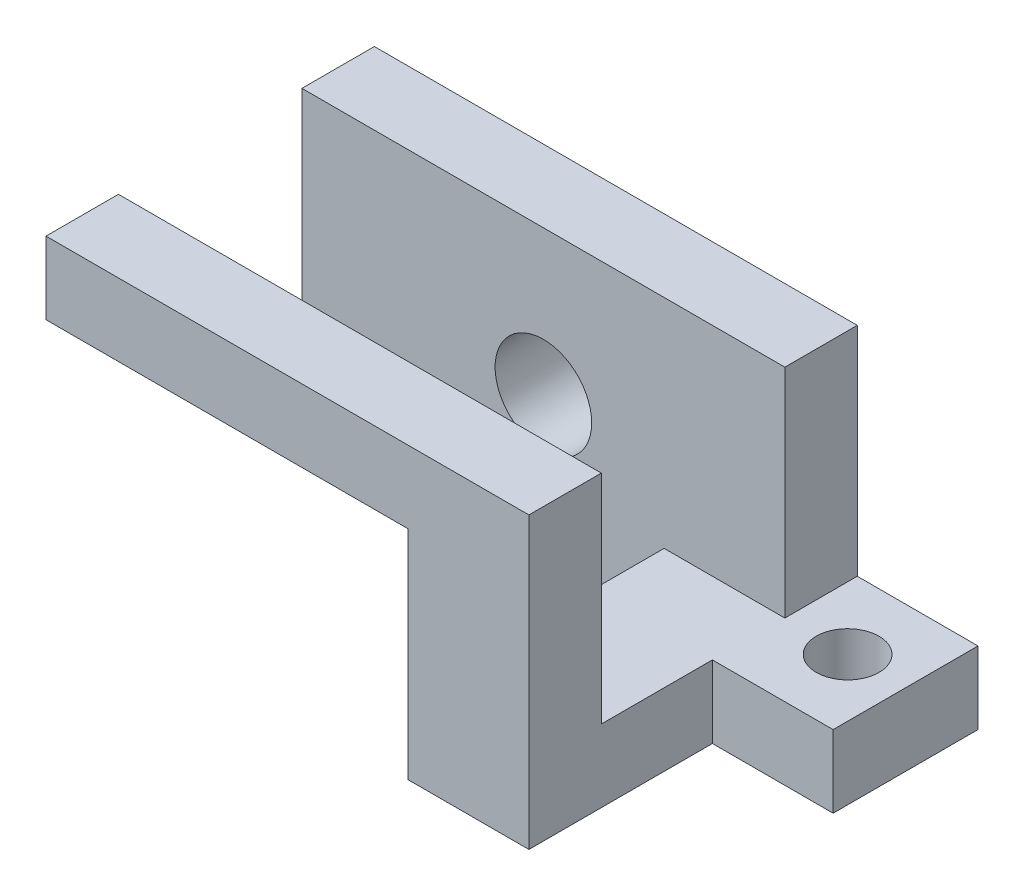
from build123d import *

# Parameters (mm, degrees)
BOSS_EXTRUDE1_DEPTH = 15
SKETCH1_5_W         = 50
SKETCH1_5_H         = 15
BOSS_EXTRUDE2_DEPTH = 30
SKETCH1_6_W         = 25
SKETCH1_6_H         = 15
BOSS_EXTRUDE3_DEPTH = 53
BOSS_EXTRUDE4_DEPTH = 15
CUT_EXTRUDE1_DEPTH  = 15


with BuildPart() as part:
    # Sketch1 → Boss-Extrude1 (new body)
    with BuildSketch(Plane.XY):
        Polygon((-50, -30), (0, -30), (25, -30), (25, -15), (50, -15), (50, 30), (-50, 30), align=None)
        with BuildLine():
            ThreePointArc((10, 0), (7.071067812, -7.071067812), (0, -10))
            ThreePointArc((0, -10), (-7.071067812, 7.071067812), (10, 0))
        make_face(mode=Mode.SUBTRACT)
    extrude(amount=BOSS_EXTRUDE1_DEPTH)

    # Sketch1<5> → Boss-Extrude2 (add)
    with BuildSketch(Plane.XY):
        with Locations((50, -22.5)):
            Rectangle(SKETCH1_5_W, SKETCH1_5_H)
    extrude(amount=BOSS_EXTRUDE2_DEPTH)

    # Sketch1<6> → Boss-Extrude3 (add)
    with BuildSketch(Plane.XY):
        with Locations((37.5, -22.5)):
            Rectangle(SKETCH1_6_W, SKETCH1_6_H)
    extrude(amount=BOSS_EXTRUDE3_DEPTH)

    # Sketch2 → Boss-Extrude4 (add)
    with BuildSketch(Plane.XY.offset(53)):
        Polygon((50, -30), (50, 30), (-50, 30), (-50, 15), (25, 15), (25, -30), align=None)
    extrude(amount=BOSS_EXTRUDE4_DEPTH)

    # Sketch3 → Cut-Extrude1 (cut)
    with BuildSketch(Plane(origin=(0, -15, 0), x_dir=(1, 0, 0), z_dir=(0, 1, 0))):
        with BuildLine():
            ThreePointArc((63, -8.5), (58.403805922, -19.596194078), (69.5, -15))
            ThreePointArc((69.5, -15), (67.596194078, -10.403805922), (63, -8.5))
        make_face()
    extrude(amount=-CUT_EXTRUDE1_DEPTH, mode=Mode.SUBTRACT)


solid = part.part
